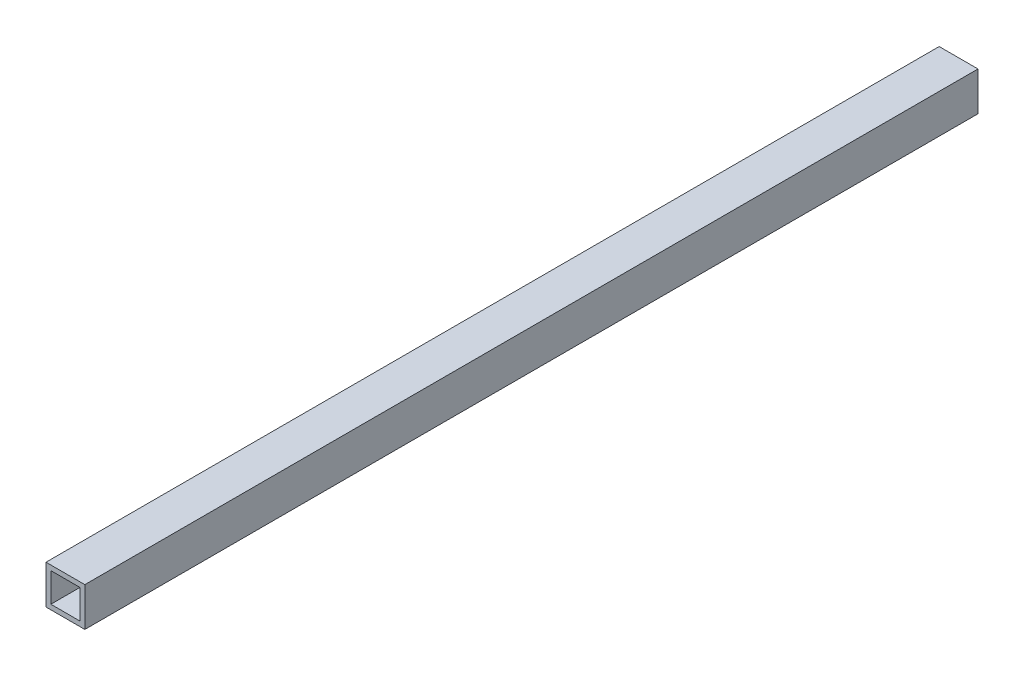
from build123d import *

# Parameters (mm, degrees)
SKETCH1_W           = 25.4
SKETCH1_H           = 25.4
SKETCH1_W_2         = 19.05
SKETCH1_H_2         = 19.05
BOSS_EXTRUDE1_DEPTH = 584.2


with BuildPart() as part:
    # Sketch1 → Boss-Extrude1 (new body)
    with BuildSketch(Plane.XY):
        with Locations((3.05078858, 1.998217396)):
            Rectangle(SKETCH1_W, SKETCH1_H)
        with Locations((3.05078858, 1.998217396)):
            Rectangle(SKETCH1_W_2, SKETCH1_H_2, mode=Mode.SUBTRACT)
    extrude(amount=BOSS_EXTRUDE1_DEPTH)


solid = part.part
